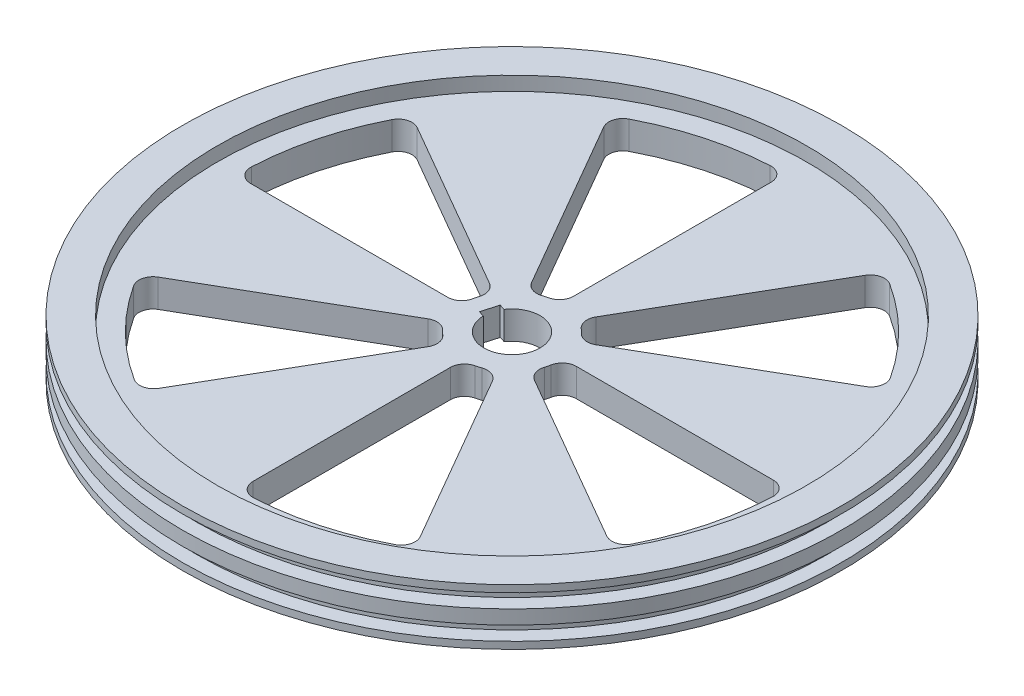
from build123d import *

# Parameters (mm, degrees)
CUT_EXTRUDE1_DEPTH = 335.738704066
SKETCH3_R          = 210
CUT_EXTRUDE2_DEPTH = 10
CUT_EXTRUDE3_START = -10
SKETCH4_R          = 210
CUT_EXTRUDE3_DEPTH = 10
CUT_EXTRUDE4_DEPTH = 334.691474269


with BuildPart() as part:
    # Sketch1 → Revolve1 (revolve)
    with BuildSketch(Plane(origin=(0, 0, 0), x_dir=(0, 0, -1), z_dir=(1, 0, 0))):
        Polygon((20, 0), (20, 40), (235, 40), (235, 35), (225, 35), (225, 25), (235, 25), (235, 15), (225, 15), (225, 5), (235, 5), (235, 0), align=None)
    revolve(axis=Axis((0, 0, 0), (0, 1, 0)))

    # Sketch2 → Cut-Extrude1 (cut, through all)
    with BuildSketch(Plane(origin=(0, 40, 0), x_dir=(1, 0, 0), z_dir=(0, 1, 0))):
        with BuildLine():
            Line((-19.995175711, -0.439258804), (-24.04880088, 0.738360519))
            Line((-24.04880088, 0.738360519), (-20.701084967, 12.261936274))
            Line((-20.701084967, 12.261936274), (-16.647459798, 11.084316951))
            ThreePointArc((-16.647459798, 11.084316951), (19.205959591, -5.579526521), (-19.995175711, -0.439258804))
        make_face()
    extrude(amount=-CUT_EXTRUDE1_DEPTH, mode=Mode.SUBTRACT)

    # Sketch3 → Cut-Extrude2 (cut)
    with BuildSketch(Plane(origin=(0, 40, 0), x_dir=(1, 0, 0), z_dir=(0, 1, 0))):
        with Locations(Location((0, 0, 0), (0, 0, 270))):
            Circle(SKETCH3_R)
    extrude(amount=-CUT_EXTRUDE2_DEPTH, mode=Mode.SUBTRACT)

    # Sketch4 → Cut-Extrude3 (cut)
    with BuildSketch(Plane.XZ.offset(CUT_EXTRUDE3_START)):
        with Locations(Location((0, 0, 0), (0, 0, 90))):
            Circle(SKETCH4_R)
    extrude(amount=CUT_EXTRUDE3_DEPTH, mode=Mode.SUBTRACT)

    # Sketch5 → Cut-Extrude4 (cut, through all)
    with BuildSketch(Plane.XZ.offset(-10)):
        with BuildLine():
            Line((0, 43.874821937), (0, 184.699253674))
            ThreePointArc((0, 184.699253674), (3.122729064, 191.958946813), (10.540628894, 194.684629))
            ThreePointArc((10.540628894, 194.684629), (51.279766456, 188.105276849), (89.721606346, 173.098939861))
            ThreePointArc((89.721606346, 173.098939861), (94.717809879, 167.027457013), (93.78003887, 159.220694609))
            Line((93.78003887, 159.220694609), (23.495497372, 37.484297749))
            ThreePointArc((23.495497372, 37.484297749), (18.316966013, 33.109992057), (11.538522594, 33.043342693))
            ThreePointArc((11.538522594, 33.043342693), (9.673276888, 33.636701893), (7.777777778, 34.124861507))
            ThreePointArc((7.777777778, 34.124861507), (2.1826404, 37.638726292), (0, 43.874821937))
        make_face()
        with BuildLine():
            Line((44.21010278, -1.605548725), (184.779185774, -1.605548725))
            ThreePointArc((184.779185774, -1.605548725), (192.008925843, 1.485698961), (194.768882461, 8.848279566))
            ThreePointArc((194.768882461, 8.848279566), (188.543831565, 49.643057974), (173.872148887, 88.213862106))
            ThreePointArc((173.872148887, 88.213862106), (167.802688955, 93.275110708), (159.954245742, 92.349626837))
            Line((159.954245742, 92.349626837), (37.996710384, 21.937410968))
            ThreePointArc((37.996710384, 21.937410968), (33.687413335, 16.929141112), (33.441885854, 10.326677613))
            ThreePointArc((33.441885854, 10.326677613), (33.966876783, 8.441047424), (34.385635495, 6.529017659))
            ThreePointArc((34.385635495, 6.529017659), (37.832577247, 0.692038141), (44.21010278, -1.605548725))
        make_face()
        with BuildLine():
            Line((20.714605407, -39.089846473), (90.999146905, -160.826243334))
            ThreePointArc((90.999146905, -160.826243334), (97.291115964, -165.541758053), (105.047276114, -164.250660295))
            ThreePointArc((105.047276114, -164.250660295), (137.264065109, -138.462218875), (163.331519993, -106.470766894))
            ThreePointArc((163.331519993, -106.470766894), (164.679959892, -98.683836105), (159.954245742, -92.349626837))
            Line((159.954245742, -92.349626837), (37.996710384, -21.937410968))
            ThreePointArc((37.996710384, -21.937410968), (31.504772935, -20.70958518), (25.664108076, -23.798183894))
            ThreePointArc((25.664108076, -23.798183894), (24.293599895, -25.195654469), (22.847112902, -26.514325035))
            ThreePointArc((22.847112902, -26.514325035), (19.515611235, -32.417953916), (20.714605407, -39.089846473))
        make_face()
        with BuildLine():
            Line((-23.495497372, -37.484297749), (-93.78003887, -159.220694609))
            ThreePointArc((-93.78003887, -159.220694609), (-94.717809879, -167.027457013), (-89.721606346, -173.098939861))
            ThreePointArc((-89.721606346, -173.098939861), (-51.279766456, -188.105276849), (-10.540628894, -194.684629))
            ThreePointArc((-10.540628894, -194.684629), (-3.122729064, -191.958946813), (0, -184.699253674))
            Line((0, -184.699253674), (0, -43.874821937))
            ThreePointArc((0, -43.874821937), (-2.1826404, -37.638726292), (-7.777777778, -34.124861507))
            ThreePointArc((-7.777777778, -34.124861507), (-9.673276888, -33.636701893), (-11.538522594, -33.043342693))
            ThreePointArc((-11.538522594, -33.043342693), (-18.316966013, -33.109992057), (-23.495497372, -37.484297749))
        make_face()
        with BuildLine():
            Line((-44.21010278, 1.605548725), (-184.779185774, 1.605548725))
            ThreePointArc((-184.779185774, 1.605548725), (-192.008925843, -1.485698961), (-194.768882461, -8.848279566))
            ThreePointArc((-194.768882461, -8.848279566), (-188.543831565, -49.643057974), (-173.872148887, -88.213862106))
            ThreePointArc((-173.872148887, -88.213862106), (-167.802688955, -93.275110708), (-159.954245742, -92.349626837))
            Line((-159.954245742, -92.349626837), (-37.996710384, -21.937410968))
            ThreePointArc((-37.996710384, -21.937410968), (-33.687413335, -16.929141112), (-33.441885854, -10.326677613))
            ThreePointArc((-33.441885854, -10.326677613), (-33.966876783, -8.441047424), (-34.385635495, -6.529017659))
            ThreePointArc((-34.385635495, -6.529017659), (-37.832577247, -0.692038141), (-44.21010278, 1.605548725))
        make_face()
        with BuildLine():
            Line((-20.714605407, 39.089846473), (-90.999146905, 160.826243334))
            ThreePointArc((-90.999146905, 160.826243334), (-97.291115964, 165.541758053), (-105.047276114, 164.250660295))
            ThreePointArc((-105.047276114, 164.250660295), (-137.264065109, 138.462218875), (-163.331519993, 106.470766894))
            ThreePointArc((-163.331519993, 106.470766894), (-164.679959892, 98.683836105), (-159.954245742, 92.349626837))
            Line((-159.954245742, 92.349626837), (-37.996710384, 21.937410968))
            ThreePointArc((-37.996710384, 21.937410968), (-31.504772935, 20.70958518), (-25.664108076, 23.798183894))
            ThreePointArc((-25.664108076, 23.798183894), (-24.293599895, 25.195654469), (-22.847112902, 26.514325035))
            ThreePointArc((-22.847112902, 26.514325035), (-19.515611235, 32.417953916), (-20.714605407, 39.089846473))
        make_face()
    extrude(amount=-CUT_EXTRUDE4_DEPTH, mode=Mode.SUBTRACT)


solid = part.part
